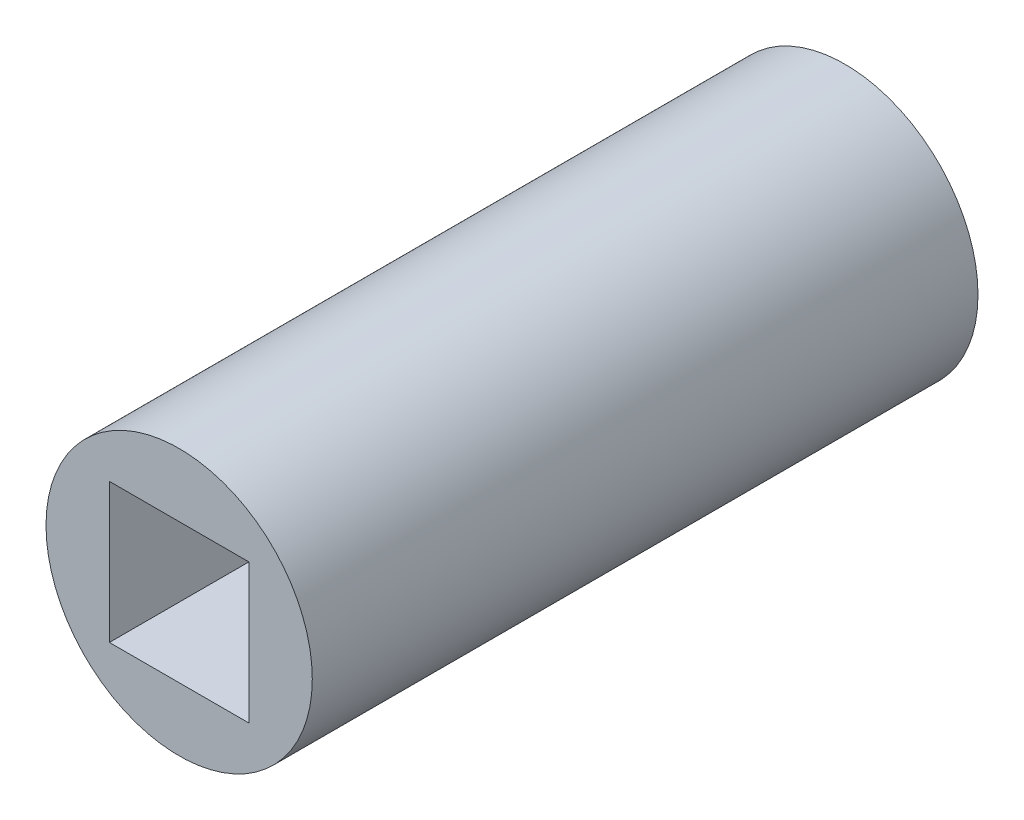
from build123d import *

# Parameters (mm, degrees)
BOSS_EXTRUDE1_DEPTH = 10
SKETCH2_R           = 3.5
BOSS_EXTRUDE2_DEPTH = 7.5
SKETCH3_W           = 3.66759605
SKETCH3_H           = 3.66756905
CUT_EXTRUDE1_DEPTH  = 5


with BuildPart() as part:
    # Sketch1 → Boss-Extrude1 (new body)
    with BuildSketch(Plane.XY):
        with BuildLine():
            ThreePointArc((-2.449489743, 2.5), (0, -3.5), (2.449489743, 2.5))
            ThreePointArc((2.449489743, 2.5), (0, 3.5), (-2.449489743, 2.5))
        make_face()
        with BuildLine():
            Line((-2, 1.5), (2, 1.5))
            ThreePointArc((2, 1.5), (0, -2.5), (-2, 1.5))
        make_face(mode=Mode.SUBTRACT)
    extrude(amount=BOSS_EXTRUDE1_DEPTH)

    # Sketch2 → Boss-Extrude2 (add)
    with BuildSketch(Plane.XY.offset(10)):
        Circle(SKETCH2_R)
    extrude(amount=BOSS_EXTRUDE2_DEPTH)

    # Sketch3 → Cut-Extrude1 (cut)
    with BuildSketch(Plane.XY.offset(17.5)):
        Rectangle(SKETCH3_W, SKETCH3_H)
    extrude(amount=-CUT_EXTRUDE1_DEPTH, mode=Mode.SUBTRACT)


solid = part.part
